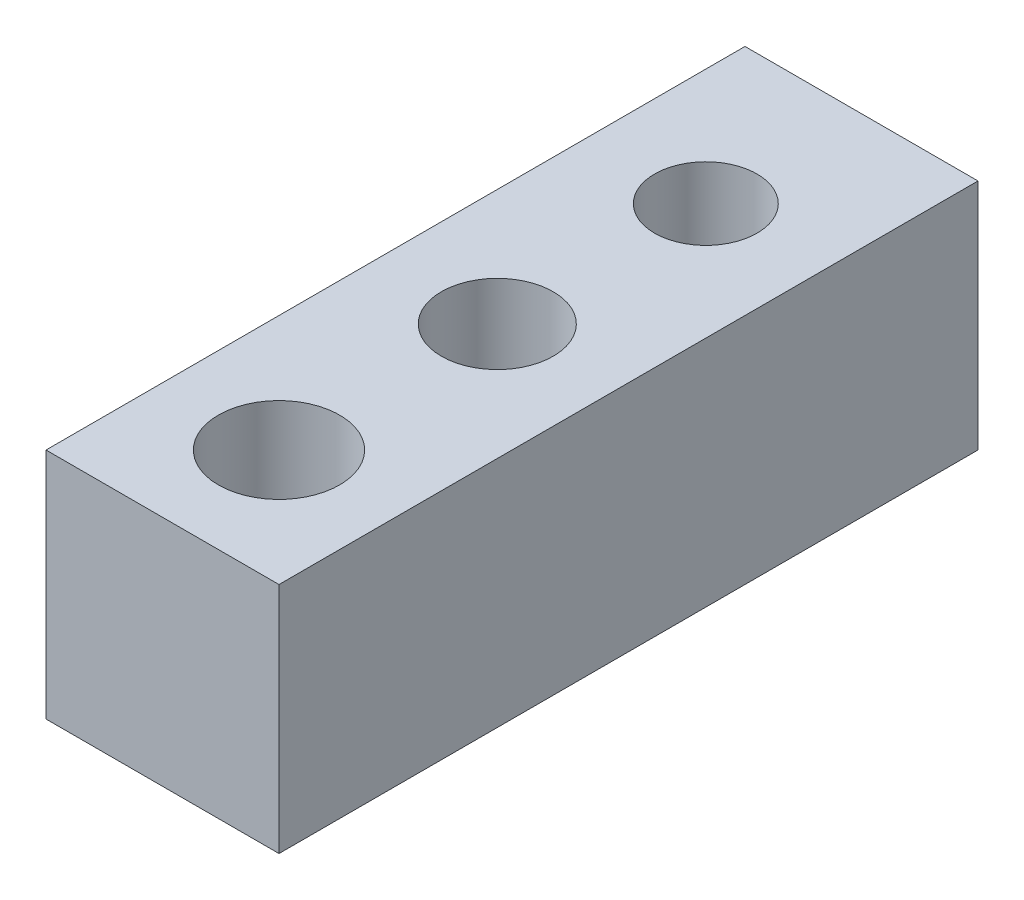
from build123d import *

# Parameters (mm, degrees)
SKETCH_1_W          = 5
SKETCH_1_H          = 15
EXTRUDE_1_DEPTH     = 5
SKETCH_2_R          = 1.3
SKETCH_2_R_2        = 1.2
SKETCH_2_R_3        = 1.1
CUT_EXTRUDE_1_DEPTH = 5


with BuildPart() as part:
    # 草图1 → 凸台-拉伸1 (new body)
    with BuildSketch(Plane(origin=(0, 0, 0), x_dir=(1, 0, 0), z_dir=(0, 1, 0))):
        with Locations((-10.380434783, -6.711956522)):
            Rectangle(SKETCH_1_W, SKETCH_1_H)
    extrude(amount=EXTRUDE_1_DEPTH)

    # 草图2 → 切除-拉伸1 (cut)
    with BuildSketch(Plane(origin=(0, 5, 0), x_dir=(1, 0, 0), z_dir=(0, 1, 0))):
        with Locations(Location((-10.380434783, -11.711956522, 0), (0, 0, 270))):
            Circle(SKETCH_2_R)
        with Locations(Location((-10.380434783, -7.02762262, 0), (0, 0, 270))):
            Circle(SKETCH_2_R_2)
        with Locations(Location((-10.380434783, -2.552955038, 0), (0, 0, 270))):
            Circle(SKETCH_2_R_3)
    extrude(amount=-CUT_EXTRUDE_1_DEPTH, mode=Mode.SUBTRACT)


solid = part.part
